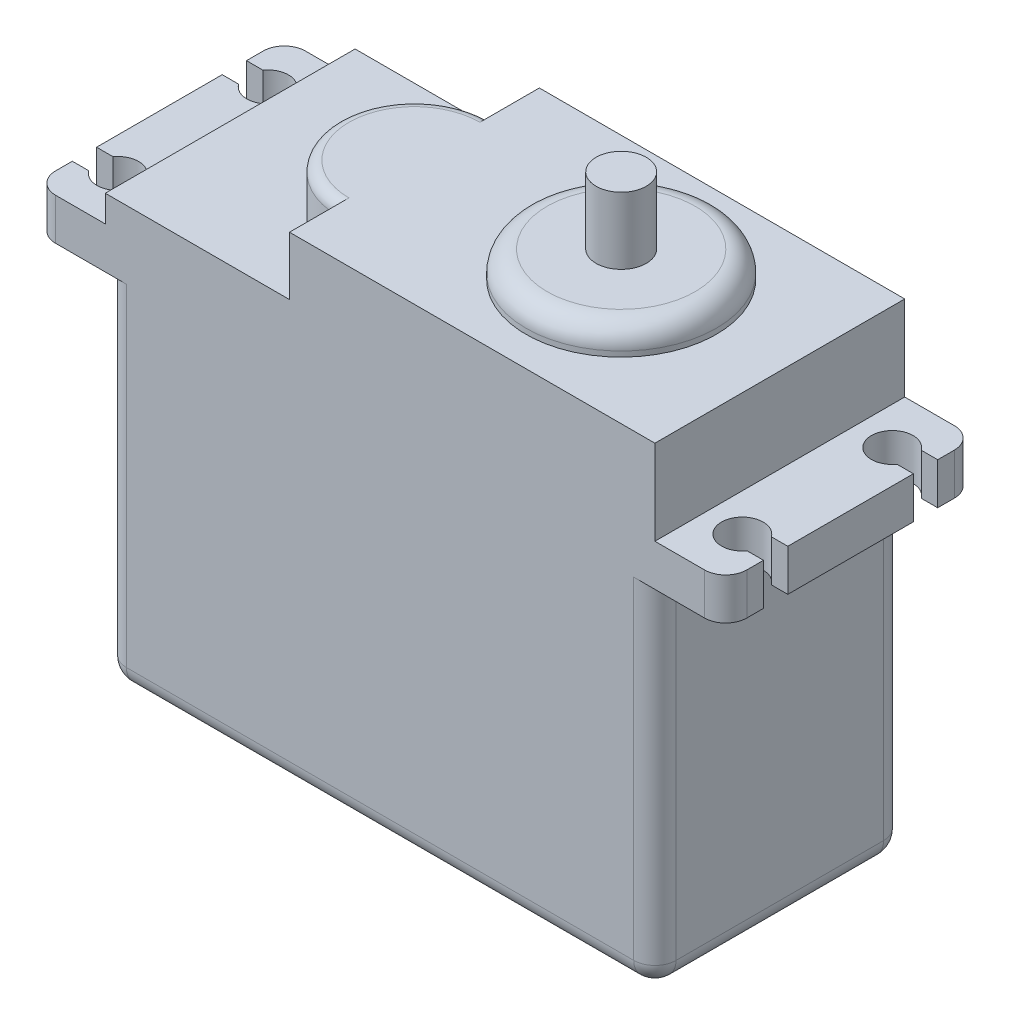
from build123d import *

# Parameters (mm, degrees)
EXTRUDE1_DEPTH     = 30
FILLET1_R          = 2.54
CUT_EXTRUDE1_REACH = 71.778
SKETCH2_R          = 2.5
CUT_EXTRUDE2_REACH = 71.778
SKETCH3_W          = 3.948997199
SKETCH3_H          = 2.915862496
SKETCH3_W_2        = 5.260004778
SKETCH3_W_3        = 4.51085759
EXTRUDE2_DEPTH     = 7.004916842
SKETCH5_R          = 11.43
EXTRUDE3_DEPTH     = 3.175
FILLET2_R          = 2.54
FILLET3_R          = 1.27
SKETCH6_R          = 3.013004542
EXTRUDE4_DEPTH     = 8.025


with BuildPart() as part:
    # Sketch1 → Extrude1 (new body)
    with BuildSketch(Plane.XY):
        Polygon((-33, 17.102458421), (-41.5, 17.102458421), (-41.5, 22.102458421), (-33, 22.102458421), (-33, 25.297541579), (-10.877689124, 25.297541579), (-10.877689124, 32.302458421), (33, 32.302458421), (33, 22.102458421), (41.5, 22.102458421), (41.5, 17.102458421), (33, 17.102458421), (33, -25.297541579), (-33, -25.297541579), align=None)
    extrude(amount=EXTRUDE1_DEPTH)

    # Fillet1
    fillet1_edges = [part.edges().sort_by_distance(p)[0] for p in [
        (33, -4.097541579, 30),
        (-41.5, 19.602458421, 0),
        (41.5, 19.602458421, 0),
        (33, -4.097541579, 0),
        (0, -25.297541579, 0),
        (41.5, 19.602458421, 30),
        (-33, -4.097541579, 0),
        (33, -25.297541579, 15),
        (-33, -25.297541579, 15),
        (-33, -4.097541579, 30),
        (-41.5, 19.602458421, 30),
        (0, -25.297541579, 30),
    ]]
    fillet(fillet1_edges, radius=FILLET1_R)

    # Sketch2 → Cut-Extrude1 (cut, up to next)
    with BuildSketch(Plane(origin=(0, 22.102458421, 0), x_dir=(1, 0, 0), z_dir=(0, 1, 0)), mode=Mode.PRIVATE) as cut_extrude1_sk1:
        with Locations(Location((-37.5, -6, 0), (0, 0, 270))):
            Circle(SKETCH2_R)
    cut_extrude1_tool1 = extrude(cut_extrude1_sk1.sketch, amount=-CUT_EXTRUDE1_REACH, mode=Mode.PRIVATE) & part.part
    # Sketch2 → Cut-Extrude1 (cut, up to next)
    with BuildSketch(Plane(origin=(0, 22.102458421, 0), x_dir=(1, 0, 0), z_dir=(0, 1, 0)), mode=Mode.PRIVATE) as cut_extrude1_sk2:
        with Locations(Location((-37.5, -24, 0), (0, 0, 270))):
            Circle(SKETCH2_R)
    cut_extrude1_tool2 = extrude(cut_extrude1_sk2.sketch, amount=-CUT_EXTRUDE1_REACH, mode=Mode.PRIVATE) & part.part
    # Sketch2 → Cut-Extrude1 (cut, up to next)
    with BuildSketch(Plane(origin=(0, 22.102458421, 0), x_dir=(1, 0, 0), z_dir=(0, 1, 0)), mode=Mode.PRIVATE) as cut_extrude1_sk3:
        with Locations(Location((37.5, -6, 0), (0, 0, 270))):
            Circle(SKETCH2_R)
    cut_extrude1_tool3 = extrude(cut_extrude1_sk3.sketch, amount=-CUT_EXTRUDE1_REACH, mode=Mode.PRIVATE) & part.part
    # Sketch2 → Cut-Extrude1 (cut, up to next)
    with BuildSketch(Plane(origin=(0, 22.102458421, 0), x_dir=(1, 0, 0), z_dir=(0, 1, 0)), mode=Mode.PRIVATE) as cut_extrude1_sk4:
        with Locations(Location((37.5, -24, 0), (0, 0, 270))):
            Circle(SKETCH2_R)
    cut_extrude1_tool4 = extrude(cut_extrude1_sk4.sketch, amount=-CUT_EXTRUDE1_REACH, mode=Mode.PRIVATE) & part.part
    add(cut_extrude1_tool1.solids().sort_by_distance((-37.5, 22.102458, 6))[0], mode=Mode.SUBTRACT)
    add(cut_extrude1_tool2.solids().sort_by_distance((-37.5, 22.102458, 24))[0], mode=Mode.SUBTRACT)
    add(cut_extrude1_tool3.solids().sort_by_distance((37.5, 22.102458, 6))[0], mode=Mode.SUBTRACT)
    add(cut_extrude1_tool4.solids().sort_by_distance((37.5, 22.102458, 24))[0], mode=Mode.SUBTRACT)

    # Sketch3 → Cut-Extrude2 (cut, up to next)
    with BuildSketch(Plane(origin=(0, 22.102458421, 0), x_dir=(1, 0, 0), z_dir=(0, 1, 0)), mode=Mode.PRIVATE) as cut_extrude2_sk1:
        with Locations((-39.525501401, -6)):
            Rectangle(SKETCH3_W, SKETCH3_H)
    cut_extrude2_tool1 = extrude(cut_extrude2_sk1.sketch, amount=-CUT_EXTRUDE2_REACH, mode=Mode.PRIVATE) & part.part
    # Sketch3 → Cut-Extrude2 (cut, up to next)
    with BuildSketch(Plane(origin=(0, 22.102458421, 0), x_dir=(1, 0, 0), z_dir=(0, 1, 0)), mode=Mode.PRIVATE) as cut_extrude2_sk2:
        with Locations((-39.525501401, -24)):
            Rectangle(SKETCH3_W, SKETCH3_H)
    cut_extrude2_tool2 = extrude(cut_extrude2_sk2.sketch, amount=-CUT_EXTRUDE2_REACH, mode=Mode.PRIVATE) & part.part
    # Sketch3 → Cut-Extrude2 (cut, up to next)
    with BuildSketch(Plane(origin=(0, 22.102458421, 0), x_dir=(1, 0, 0), z_dir=(0, 1, 0)), mode=Mode.PRIVATE) as cut_extrude2_sk3:
        with Locations((38.869997611, -6)):
            Rectangle(SKETCH3_W_2, SKETCH3_H)
    cut_extrude2_tool3 = extrude(cut_extrude2_sk3.sketch, amount=-CUT_EXTRUDE2_REACH, mode=Mode.PRIVATE) & part.part
    # Sketch3 → Cut-Extrude2 (cut, up to next)
    with BuildSketch(Plane(origin=(0, 22.102458421, 0), x_dir=(1, 0, 0), z_dir=(0, 1, 0)), mode=Mode.PRIVATE) as cut_extrude2_sk4:
        with Locations((39.244571205, -24)):
            Rectangle(SKETCH3_W_3, SKETCH3_H)
    cut_extrude2_tool4 = extrude(cut_extrude2_sk4.sketch, amount=-CUT_EXTRUDE2_REACH, mode=Mode.PRIVATE) & part.part
    add(cut_extrude2_tool1.solids().sort_by_distance((-39.525501, 22.102458, 6))[0], mode=Mode.SUBTRACT)
    add(cut_extrude2_tool2.solids().sort_by_distance((-39.525501, 22.102458, 24))[0], mode=Mode.SUBTRACT)
    add(cut_extrude2_tool3.solids().sort_by_distance((38.869998, 22.102458, 6))[0], mode=Mode.SUBTRACT)
    add(cut_extrude2_tool4.solids().sort_by_distance((39.244571, 22.102458, 24))[0], mode=Mode.SUBTRACT)

    # Sketch4 → Extrude2 (add)
    with BuildSketch(Plane(origin=(0, 25.297541579, 0), x_dir=(1, 0, 0), z_dir=(0, 1, 0))):
        with BuildLine():
            Line((-10.877689124, -5.869768646), (-10.877689124, -24.130231354))
            ThreePointArc((-10.877689124, -24.130231354), (-20.007920479, -15), (-10.877689124, -5.869768646))
        make_face()
    extrude(amount=EXTRUDE2_DEPTH)

    # Sketch5 → Extrude3 (add)
    with BuildSketch(Plane(origin=(0, 32.302458421, 0), x_dir=(1, 0, 0), z_dir=(0, 1, 0))):
        with Locations(Location((13.95, -15, 0), (0, 0, 90))):
            Circle(SKETCH5_R)
    extrude(amount=EXTRUDE3_DEPTH)

    # Fillet2
    fillet2_edges = [part.edges().sort_by_distance(p)[0] for p in [
        (13.95, 35.477458421, 26.43),
    ]]
    fillet(fillet2_edges, radius=FILLET2_R)

    # Fillet3
    fillet3_edges = [part.edges().sort_by_distance(p)[0] for p in [
        (-20.007920479, 32.302458421, 15),
    ]]
    fillet(fillet3_edges, radius=FILLET3_R)

    # Sketch6 → Extrude4 (add)
    with BuildSketch(Plane(origin=(0, 35.477458421, 0), x_dir=(1, 0, 0), z_dir=(0, 1, 0))):
        with Locations(Location((13.95, -15, 0), (0, 0, 270))):
            Circle(SKETCH6_R)
    extrude(amount=EXTRUDE4_DEPTH)


solid = part.part
